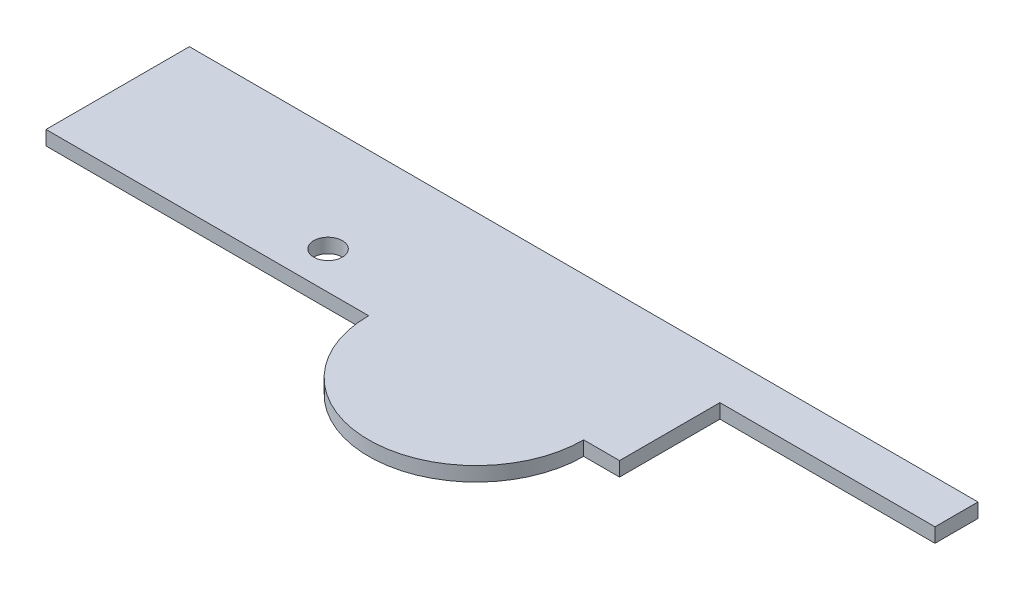
from build123d import *

# Parameters (mm, degrees)
BOSS_EXTRUDE6_DEPTH = 1
SKETCH7_R           = 1
CUT_EXTRUDE1_DEPTH  = 10


with BuildPart() as part:
    # Sketch3 → Boss-Extrude6 (new body)
    with BuildSketch(Plane(origin=(0, 0, 0), x_dir=(1, 0, 0), z_dir=(0, 1, 0))):
        with BuildLine():
            Line((24.032258065, -5), (26.532258065, -5))
            Line((26.532258065, -5), (26.532258065, 2))
            Line((26.532258065, 2), (41.532258065, 2))
            Line((41.532258065, 2), (41.532258065, 5))
            Line((41.532258065, 5), (26.532258065, 5))
            Line((26.532258065, 5), (-13.467741935, 5))
            Line((-13.467741935, 5), (-13.467741935, -5))
            Line((-13.467741935, -5), (9.032258065, -5))
            ThreePointArc((9.032258065, -5), (16.532258065, -12.5), (24.032258065, -5))
        make_face()
    extrude(amount=BOSS_EXTRUDE6_DEPTH)

    # Sketch7 → Cut-Extrude1 (cut)
    with BuildSketch(Plane.XZ):
        with Locations(Location((3.582258065, 2.38, 0), (0, 0, 270))):
            Circle(SKETCH7_R)
    extrude(amount=-CUT_EXTRUDE1_DEPTH, mode=Mode.SUBTRACT)


solid = part.part
